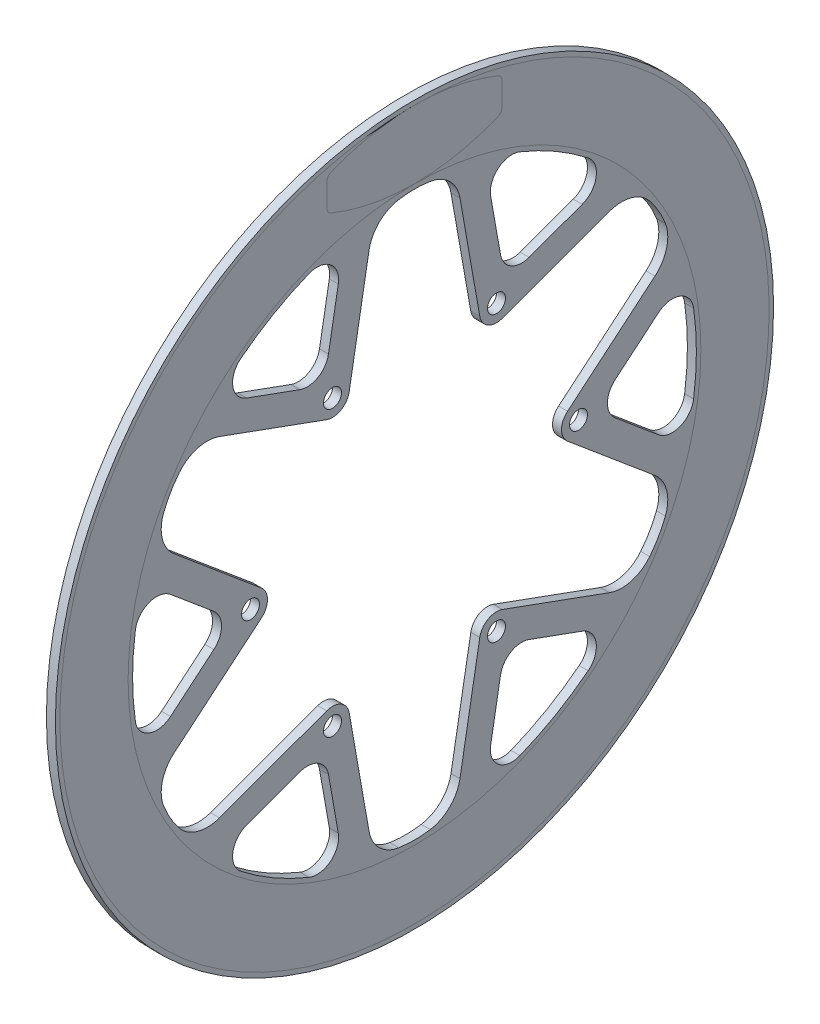
from build123d import *

# Parameters (mm, degrees)
SKETCH1_R           = 127
SKETCH1_R_2         = 3.175
BOSS_EXTRUDE1_DEPTH = 3.175


with BuildPart() as part:
    # Sketch1 → Boss-Extrude1 (new body)
    with BuildSketch(Plane(origin=(0, 0, 0), x_dir=(0, 0, -1), z_dir=(1, 0, 0))):
        Circle(SKETCH1_R)
        with BuildLine():
            ThreePointArc((-40.533501272, -58.531566299), (-34.11730778, -59.092910493), (-30.423072702, -64.368824956))
            Line((-30.423072702, -64.368824956), (-26.950595308, -84.062222874))
            ThreePointArc((-26.950595308, -84.062222874), (-29.658123464, -91.306232972), (-37.306264624, -92.451801739))
            ThreePointArc((-37.306264624, -92.451801739), (-49.8475, -86.33840263), (-61.412476619, -78.534073754))
            ThreePointArc((-61.412476619, -78.534073754), (-64.244455546, -71.337804834), (-59.324722854, -65.371011621))
            Line((-59.324722854, -65.371011621), (-40.533501272, -58.531566299))
        make_face(mode=Mode.SUBTRACT)
        with BuildLine():
            ThreePointArc((-70.956573975, 5.837258657), (-68.234615561, 0), (-70.956573975, -5.837258657))
            Line((-70.956573975, -5.837258657), (-86.275318162, -18.691211254))
            ThreePointArc((-86.275318162, -18.691211254), (-93.90257901, -19.968428138), (-98.718741244, -13.917727985))
            ThreePointArc((-98.718741244, -13.917727985), (-99.695, 0), (-98.718741244, 13.917727985))
            ThreePointArc((-98.718741244, 13.917727985), (-93.90257901, 19.968428138), (-86.275318162, 18.691211254))
            Line((-86.275318162, 18.691211254), (-70.956573975, 5.837258657))
        make_face(mode=Mode.SUBTRACT)
        with Locations((-29, -50.229473419)):
            Circle(SKETCH1_R_2, mode=Mode.SUBTRACT)
        with BuildLine():
            ThreePointArc((30.423072702, -64.368824956), (34.11730778, -59.092910493), (40.533501272, -58.531566299))
            Line((40.533501272, -58.531566299), (59.324722854, -65.371011621))
            ThreePointArc((59.324722854, -65.371011621), (64.244455546, -71.337804834), (61.412476619, -78.534073754))
            ThreePointArc((61.412476619, -78.534073754), (49.8475, -86.33840263), (37.306264624, -92.451801739))
            ThreePointArc((37.306264624, -92.451801739), (29.658123464, -91.306232972), (26.950595308, -84.062222874))
            Line((26.950595308, -84.062222874), (30.423072702, -64.368824956))
        make_face(mode=Mode.SUBTRACT)
        with Locations((29, -50.229473419)):
            Circle(SKETCH1_R_2, mode=Mode.SUBTRACT)
        with BuildLine():
            Line((16.085518962, 88.918512041), (23.091153482, 49.187584353))
            ThreePointArc((23.091153482, 49.187584353), (24.085087734, 46.788014801), (26, 45.033320997))
            ThreePointArc((26, 45.033320997), (28.477065544, 44.252305231), (31.05212086, 44.591317695))
            Line((31.05212086, 44.591317695), (68.962930813, 58.389724075))
            ThreePointArc((68.962930813, 58.389724075), (76.699872074, 58.693912553), (83.175501835, 54.449032119))
            ThreePointArc((83.175501835, 54.449032119), (86.33840263, 49.8475), (88.741995944, 44.807581502))
            ThreePointArc((88.741995944, 44.807581502), (89.180355355, 37.077081406), (85.048449775, 30.528787966))
            Line((85.048449775, 30.528787966), (54.143274342, 4.596266659))
            ThreePointArc((54.143274342, 4.596266659), (52.562153278, 2.53570957), (52, 0))
            ThreePointArc((52, 0), (52.562153278, -2.53570957), (54.143274342, -4.596266659))
            Line((54.143274342, -4.596266659), (85.048449775, -30.528787966))
            ThreePointArc((85.048449775, -30.528787966), (89.180355355, -37.077081406), (88.741995944, -44.807581502))
            ThreePointArc((88.741995944, -44.807581502), (86.33840263, -49.8475), (83.175501835, -54.449032119))
            ThreePointArc((83.175501835, -54.449032119), (76.699872074, -58.693912553), (68.962930813, -58.389724075))
            Line((68.962930813, -58.389724075), (31.05212086, -44.591317695))
            ThreePointArc((31.05212086, -44.591317695), (28.477065544, -44.252305231), (26, -45.033320997))
            ThreePointArc((26, -45.033320997), (24.085087734, -46.788014801), (23.091153482, -49.187584353))
            Line((23.091153482, -49.187584353), (16.085518962, -88.918512041))
            ThreePointArc((16.085518962, -88.918512041), (12.480483281, -95.770993959), (5.566494109, -99.256613621))
            ThreePointArc((5.566494109, -99.256613621), (0, -99.695), (-5.566494109, -99.256613621))
            ThreePointArc((-5.566494109, -99.256613621), (-12.480483281, -95.770993959), (-16.085518962, -88.918512041))
            Line((-16.085518962, -88.918512041), (-23.091153482, -49.187584353))
            ThreePointArc((-23.091153482, -49.187584353), (-24.085087734, -46.788014801), (-26, -45.033320997))
            ThreePointArc((-26, -45.033320997), (-28.477065544, -44.252305231), (-31.05212086, -44.591317695))
            Line((-31.05212086, -44.591317695), (-68.962930813, -58.389724075))
            ThreePointArc((-68.962930813, -58.389724075), (-76.699872074, -58.693912553), (-83.175501835, -54.449032119))
            ThreePointArc((-83.175501835, -54.449032119), (-86.33840263, -49.8475), (-88.741995944, -44.807581502))
            ThreePointArc((-88.741995944, -44.807581502), (-89.180355355, -37.077081406), (-85.048449775, -30.528787966))
            Line((-85.048449775, -30.528787966), (-54.143274342, -4.596266659))
            ThreePointArc((-54.143274342, -4.596266659), (-52.562153278, -2.53570957), (-52, 0))
            ThreePointArc((-52, 0), (-52.562153278, 2.53570957), (-54.143274342, 4.596266659))
            Line((-54.143274342, 4.596266659), (-85.048449775, 30.528787966))
            ThreePointArc((-85.048449775, 30.528787966), (-89.180355355, 37.077081406), (-88.741995944, 44.807581502))
            ThreePointArc((-88.741995944, 44.807581502), (-86.33840263, 49.8475), (-83.175501835, 54.449032119))
            ThreePointArc((-83.175501835, 54.449032119), (-76.699872074, 58.693912553), (-68.962930813, 58.389724075))
            Line((-68.962930813, 58.389724075), (-31.05212086, 44.591317695))
            ThreePointArc((-31.05212086, 44.591317695), (-28.477065544, 44.252305231), (-26, 45.033320997))
            ThreePointArc((-26, 45.033320997), (-24.085087734, 46.788014801), (-23.091153482, 49.187584353))
            Line((-23.091153482, 49.187584353), (-16.085518962, 88.918512041))
            ThreePointArc((-16.085518962, 88.918512041), (-12.480483281, 95.770993959), (-5.566494109, 99.256613621))
            ThreePointArc((-5.566494109, 99.256613621), (0, 99.695), (5.566494109, 99.256613621))
            ThreePointArc((5.566494109, 99.256613621), (12.480483281, 95.770993959), (16.085518962, 88.918512041))
        make_face(mode=Mode.SUBTRACT)
        with Locations((-58, 0)):
            Circle(SKETCH1_R_2, mode=Mode.SUBTRACT)
        with Locations((-29, 50.229473419)):
            Circle(SKETCH1_R_2, mode=Mode.SUBTRACT)
        with BuildLine():
            ThreePointArc((-30.423072702, 64.368824956), (-34.11730778, 59.092910493), (-40.533501272, 58.531566299))
            Line((-40.533501272, 58.531566299), (-59.324722854, 65.371011621))
            ThreePointArc((-59.324722854, 65.371011621), (-64.244455546, 71.337804834), (-61.412476619, 78.534073754))
            ThreePointArc((-61.412476619, 78.534073754), (-49.8475, 86.33840263), (-37.306264624, 92.451801739))
            ThreePointArc((-37.306264624, 92.451801739), (-29.658123464, 91.306232972), (-26.950595308, 84.062222874))
            Line((-26.950595308, 84.062222874), (-30.423072702, 64.368824956))
        make_face(mode=Mode.SUBTRACT)
        with Locations((58, 0)):
            Circle(SKETCH1_R_2, mode=Mode.SUBTRACT)
        with Locations((29, 50.229473419)):
            Circle(SKETCH1_R_2, mode=Mode.SUBTRACT)
        with BuildLine():
            ThreePointArc((70.956573975, -5.837258657), (68.234615561, 0), (70.956573975, 5.837258657))
            Line((70.956573975, 5.837258657), (86.275318162, 18.691211254))
            ThreePointArc((86.275318162, 18.691211254), (93.90257901, 19.968428138), (98.718741244, 13.917727985))
            ThreePointArc((98.718741244, 13.917727985), (99.695, 0), (98.718741244, -13.917727985))
            ThreePointArc((98.718741244, -13.917727985), (93.90257901, -19.968428138), (86.275318162, -18.691211254))
            Line((86.275318162, -18.691211254), (70.956573975, -5.837258657))
        make_face(mode=Mode.SUBTRACT)
        with BuildLine():
            ThreePointArc((40.533501272, 58.531566299), (34.11730778, 59.092910493), (30.423072702, 64.368824956))
            Line((30.423072702, 64.368824956), (26.950595308, 84.062222874))
            ThreePointArc((26.950595308, 84.062222874), (29.658123464, 91.306232972), (37.306264624, 92.451801739))
            ThreePointArc((37.306264624, 92.451801739), (49.8475, 86.33840263), (61.412476619, 78.534073754))
            ThreePointArc((61.412476619, 78.534073754), (64.244455546, 71.337804834), (59.324722854, 65.371011621))
            Line((59.324722854, 65.371011621), (40.533501272, 58.531566299))
        make_face(mode=Mode.SUBTRACT)
    extrude(amount=BOSS_EXTRUDE1_DEPTH)


solid = part.part
